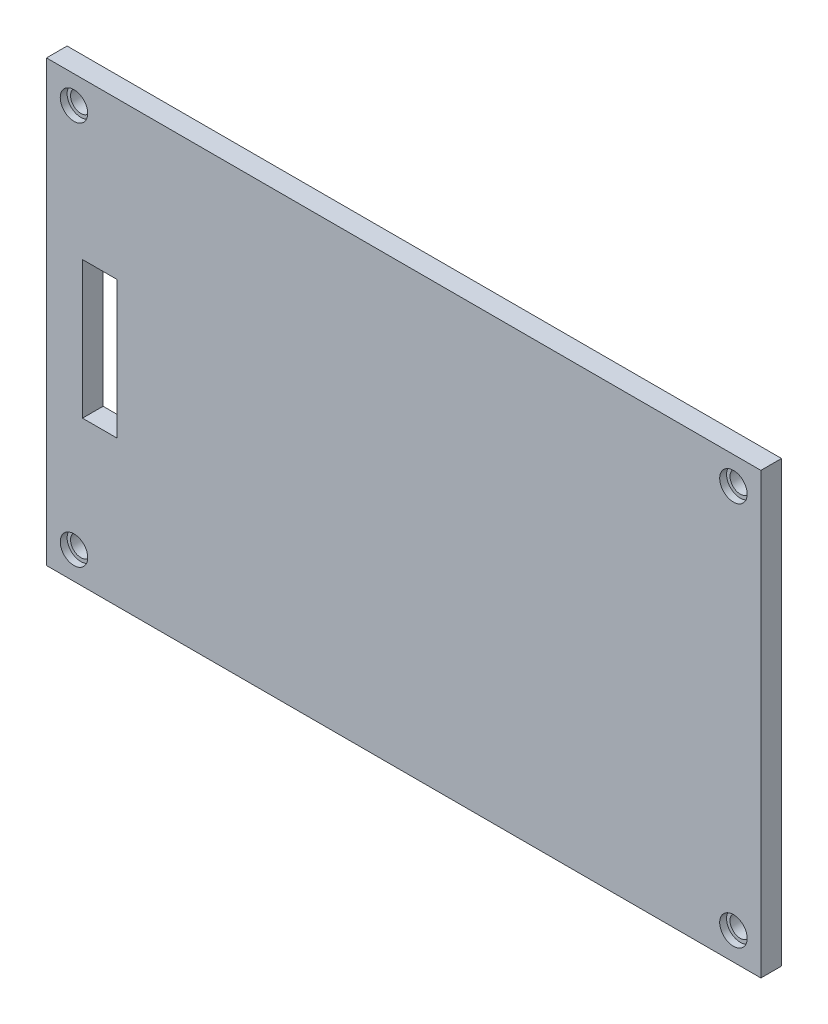
from build123d import *

# Parameters (mm, degrees)
SKETCH_1_W          = 104
SKETCH_1_H          = 64
EXTRUDE_1_DEPTH     = 3
SKETCH_2_R          = 1.5
CUT_EXTRUDE_1_DEPTH = 62.131006862
SKETCH_3_W          = 5
SKETCH_3_H          = 20
CUT_EXTRUDE_2_DEPTH = 62.131006862
SKETCH_4_R          = 2
CUT_EXTRUDE_3_DEPTH = 1


with BuildPart() as part:
    # 草图1 → 凸台-拉伸1 (new body)
    with BuildSketch(Plane.XY):
        Rectangle(SKETCH_1_W, SKETCH_1_H)
    extrude(amount=EXTRUDE_1_DEPTH)

    # 草图2 → 切除-拉伸1 (cut, through all)
    with BuildSketch(Plane.XY.offset(3)):
        with Locations((-48, 28)):
            Circle(SKETCH_2_R)
        with Locations(Location((48, 28, 0), (0, 0, 180))):
            Circle(SKETCH_2_R)
        with Locations((48, -28)):
            Circle(SKETCH_2_R)
        with Locations(Location((-48, -28, 0), (0, 0, 180))):
            Circle(SKETCH_2_R)
    extrude(amount=-CUT_EXTRUDE_1_DEPTH, mode=Mode.SUBTRACT)

    # 草图3 → 切除-拉伸2 (cut, through all)
    with BuildSketch(Plane(origin=(0, 0, 0), x_dir=(-1, 0, 0), z_dir=(0, 0, -1))):
        with Locations((44.26005687, -0.800014708)):
            Rectangle(SKETCH_3_W, SKETCH_3_H)
    extrude(amount=-CUT_EXTRUDE_2_DEPTH, mode=Mode.SUBTRACT)

    # 草图4 → 切除-拉伸3 (cut)
    with BuildSketch(Plane.XY.offset(3)):
        with Locations((48, 28)):
            Circle(SKETCH_4_R)
        with Locations(Location((-48, 28, 0), (0, 0, 180))):
            Circle(SKETCH_4_R)
        with Locations((-48, -28)):
            Circle(SKETCH_4_R)
        with Locations(Location((48, -28, 0), (0, 0, 180))):
            Circle(SKETCH_4_R)
    extrude(amount=-CUT_EXTRUDE_3_DEPTH, mode=Mode.SUBTRACT)


solid = part.part
